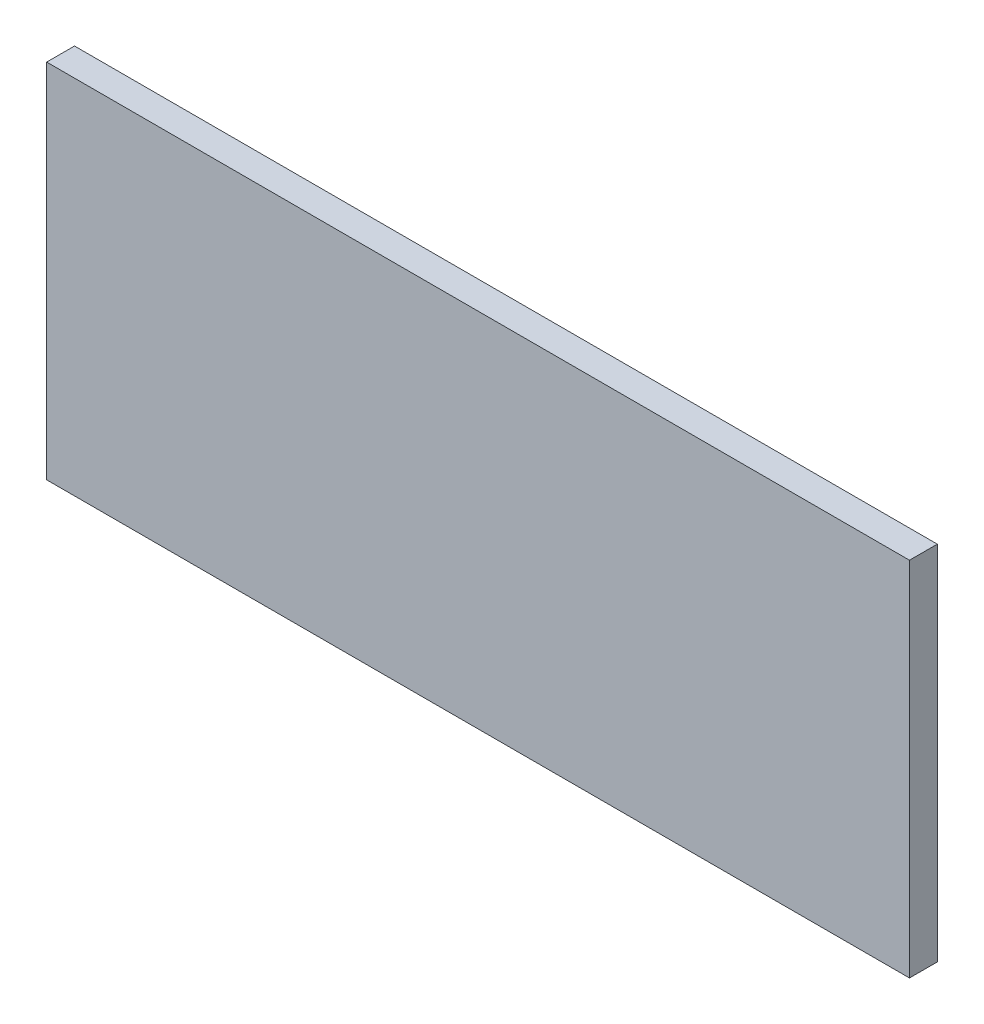
from build123d import *

# Parameters (mm, degrees)
SKETCH_1_W      = 620
SKETCH_1_H      = 260
EXTRUDE_1_DEPTH = 20


with BuildPart() as part:
    # 草图1 → 凸台-拉伸1 (new body)
    with BuildSketch(Plane.XY):
        Rectangle(SKETCH_1_W, SKETCH_1_H)
    extrude(amount=EXTRUDE_1_DEPTH)


solid = part.part
